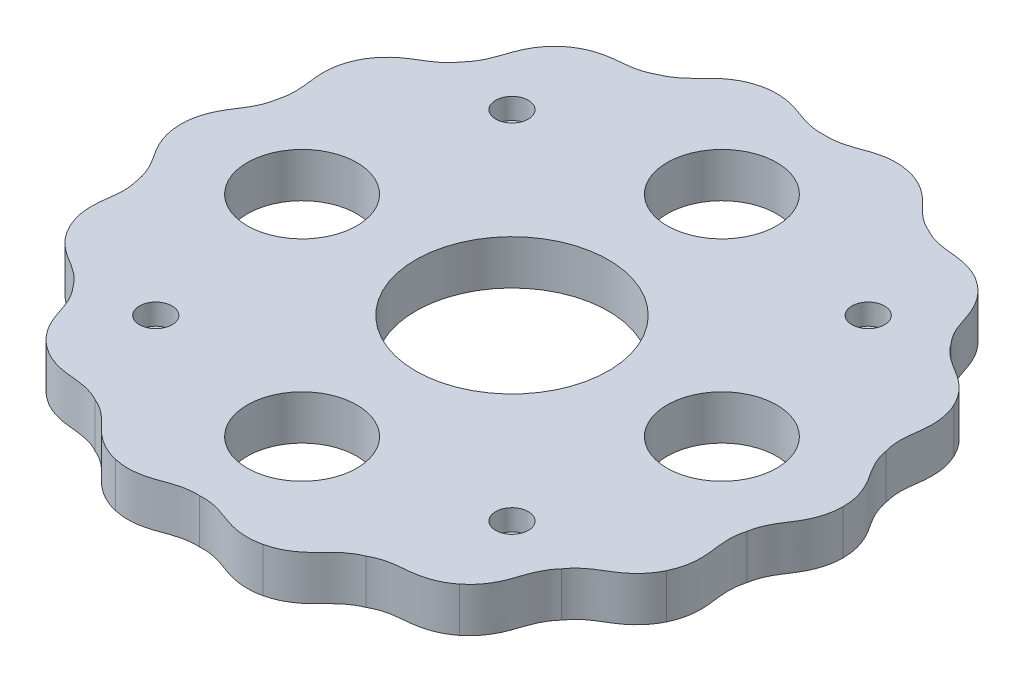
from build123d import *

# Parameters (mm, degrees)
BOSS_EXTRUDE3_DEPTH = 4.7625
SKETCH2_R           = 5.875
SKETCH2_R_2         = 10.328125
CUT_EXTRUDE1_DEPTH  = 4.7625
SKETCH2_4_R         = 1.75
CUT_EXTRUDE2_DEPTH  = 2.245833333


with BuildPart() as part:
    # Sketch1 → Boss-Extrude3 (new body)
    with BuildSketch(Plane(origin=(0, 0, 0), x_dir=(1, 0, 0), z_dir=(0, 1, 0))):
        with BuildLine():
            Line((35.500002326, 0.003735881), (35.500002326, 0))
            Line((35.500002326, 0), (35.500002326, -0.003735881))
            add(Edge.make_bspline(
                [(32.644810899, -7.45096506), (32.674793712, -7.260710929), (32.757965618, -6.873262555), (32.975088878, -6.197475635), (33.30681421, -5.487322542), (33.693887271, -4.83935734), (34.139372051, -4.165162167), (34.499748971, -3.6014921), (34.870711868, -2.889611748), (35.149566879, -2.192738575), (35.418263863, -1.23361479), (35.50061524, -0.495919336), (35.500002326, -0.003735881)],
                knots=[0.02301065, 0.02301065, 0.02301065, 0.02301065, 0.053541567, 0.084072485, 0.145134319, 0.206196153, 0.267257988, 0.389381656, 0.511505325, 0.633628994, 0.755752663, 1, 1, 1, 1], degree=3))
            add(Edge.make_bspline(
                [(31.986017844, -15.399507835), (32.200120458, -14.956331799), (32.445998494, -14.255960238), (32.62005909, -13.275236314), (32.671181344, -12.526384626), (32.645828632, -11.724047822), (32.565707523, -11.059836954), (32.456861927, -10.25911949), (32.389262714, -9.507378309), (32.398512397, -8.723622254), (32.496104055, -8.020553026), (32.589276306, -7.635387164), (32.644810899, -7.45096506)],
                knots=[0.02301065, 0.02301065, 0.02301065, 0.02301065, 0.267257988, 0.389381656, 0.511505325, 0.633628994, 0.755752663, 0.816814497, 0.877876331, 0.938938166, 0.969469083, 1, 1, 1, 1], degree=3))
            Line((31.986017844, -15.399507835), (31.984396906, -15.402873748))
            Line((31.984396906, -15.402873748), (31.982775968, -15.406239661))
            add(Edge.make_bspline(
                [(26.179105738, -20.877140171), (26.288667493, -20.718736177), (26.531710341, -20.405744191), (27.020544594, -19.891087467), (27.62754267, -19.395191866), (28.257425012, -18.979340099), (28.951315253, -18.565199839), (29.520570914, -18.213712342), (30.163670245, -17.733285076), (30.717271866, -17.226414698), (31.375507699, -16.478857279), (31.769777787, -15.849947564), (31.982775968, -15.406239661)],
                knots=[0.02301065, 0.02301065, 0.02301065, 0.02301065, 0.053541567, 0.084072485, 0.145134319, 0.206196153, 0.267257988, 0.389381656, 0.511505325, 0.633628994, 0.755752663, 1, 1, 1, 1], degree=3))
            add(Edge.make_bspline(
                [(22.136810246, -27.752690162), (22.521996911, -27.446297993), (23.047405198, -26.921967502), (23.62974854, -26.113887841), (24.00072267, -25.461376898), (24.326001557, -24.727496287), (24.542005228, -24.094299727), (24.791357022, -23.325651886), (25.05662051, -22.619026286), (25.405013194, -21.916899767), (25.797990545, -21.325799714), (26.049053047, -21.019203188), (26.179105738, -20.877140171)],
                knots=[0.02301065, 0.02301065, 0.02301065, 0.02301065, 0.267257988, 0.389381656, 0.511505325, 0.633628994, 0.755752663, 0.816814497, 0.877876331, 0.938938166, 0.969469083, 1, 1, 1, 1], degree=3))
            Line((22.136810246, -27.752690162), (22.133889416, -27.755019446))
            Line((22.133889416, -27.755019446), (22.130968587, -27.75734873))
            add(Edge.make_bspline(
                [(14.52830762, -30.168341629), (14.695748267, -30.073161626), (15.05052444, -29.89661793), (15.714250068, -29.645025478), (16.476297475, -29.461605575), (17.224233175, -29.360231784), (18.029095404, -29.288171996), (18.694481743, -29.218483478), (19.482343797, -29.064663811), (20.201044438, -28.848188121), (21.118447439, -28.460259983), (21.746546212, -28.06469929), (22.130968587, -27.75734873)],
                knots=[0.02301065, 0.02301065, 0.02301065, 0.02301065, 0.053541567, 0.084072485, 0.145134319, 0.206196153, 0.267257988, 0.389381656, 0.511505325, 0.633628994, 0.755752663, 1, 1, 1, 1], degree=3))
            add(Edge.make_bspline(
                [(7.903135888, -34.609111839), (8.383115662, -34.500188263), (9.083990645, -34.255748926), (9.959276491, -33.780363616), (10.576626521, -33.353431213), (11.188111536, -32.833360849), (11.657457809, -32.356590942), (12.215619812, -31.772252855), (12.761207314, -31.250698702), (13.379739556, -30.769266488), (13.990268616, -30.407210225), (14.349495361, -30.239908237), (14.52830762, -30.168341629)],
                knots=[0.02301065, 0.02301065, 0.02301065, 0.02301065, 0.267257988, 0.389381656, 0.511505325, 0.633628994, 0.755752663, 0.816814497, 0.877876331, 0.938938166, 0.969469083, 1, 1, 1, 1], degree=3))
            Line((7.903135888, -34.609111839), (7.899493673, -34.60994315))
            Line((7.899493673, -34.60994315), (7.895851458, -34.610774462))
            add(Edge.make_bspline(
                [(0, -33.484333037), (0.192155866, -33.471228592), (0.588397592, -33.466099831), (1.295555593, -33.527402621), (2.061719496, -33.692786976), (2.779570716, -33.925969485), (3.535992098, -34.210262493), (4.165721189, -34.43617562), (4.942300224, -34.639429423), (5.683752409, -34.756224087), (6.678619663, -34.804759157), (7.416144457, -34.72089313), (7.895851458, -34.610774462)],
                knots=[0.02301065, 0.02301065, 0.02301065, 0.02301065, 0.053541567, 0.084072485, 0.145134319, 0.206196153, 0.267257988, 0.389381656, 0.511505325, 0.633628994, 0.755752663, 1, 1, 1, 1], degree=3))
            add(Edge.make_bspline(
                [(-7.895851458, -34.610774462), (-7.416144457, -34.72089313), (-6.678619663, -34.804759157), (-5.683752409, -34.756224087), (-4.942300224, -34.639429423), (-4.165721189, -34.43617562), (-3.535992098, -34.210262493), (-2.779570716, -33.925969485), (-2.061719496, -33.692786976), (-1.295555593, -33.527402621), (-0.588397592, -33.466099831), (-0.192155866, -33.471228592), (0, -33.484333037)],
                knots=[0.02301065, 0.02301065, 0.02301065, 0.02301065, 0.267257988, 0.389381656, 0.511505325, 0.633628994, 0.755752663, 0.816814497, 0.877876331, 0.938938166, 0.969469083, 1, 1, 1, 1], degree=3))
            Line((-7.895851458, -34.610774462), (-7.899493673, -34.60994315))
            Line((-7.899493673, -34.60994315), (-7.903135888, -34.609111839))
            add(Edge.make_bspline(
                [(-14.52830762, -30.168341629), (-14.349495361, -30.239908237), (-13.990268616, -30.407210225), (-13.379739556, -30.769266488), (-12.761207314, -31.250698702), (-12.215619812, -31.772252855), (-11.657457809, -32.356590942), (-11.188111536, -32.833360849), (-10.576626521, -33.353431213), (-9.959276491, -33.780363616), (-9.083990645, -34.255748926), (-8.383115662, -34.500188263), (-7.903135888, -34.609111839)],
                knots=[0.02301065, 0.02301065, 0.02301065, 0.02301065, 0.053541567, 0.084072485, 0.145134319, 0.206196153, 0.267257988, 0.389381656, 0.511505325, 0.633628994, 0.755752663, 1, 1, 1, 1], degree=3))
            add(Edge.make_bspline(
                [(-22.130968587, -27.75734873), (-21.746546212, -28.06469929), (-21.118447439, -28.460259983), (-20.201044438, -28.848188121), (-19.482343797, -29.064663811), (-18.694481743, -29.218483478), (-18.029095404, -29.288171996), (-17.224233175, -29.360231784), (-16.476297475, -29.461605575), (-15.714250068, -29.645025478), (-15.05052444, -29.89661793), (-14.695748267, -30.073161626), (-14.52830762, -30.168341629)],
                knots=[0.02301065, 0.02301065, 0.02301065, 0.02301065, 0.267257988, 0.389381656, 0.511505325, 0.633628994, 0.755752663, 0.816814497, 0.877876331, 0.938938166, 0.969469083, 1, 1, 1, 1], degree=3))
            Line((-22.130968587, -27.75734873), (-22.133889416, -27.755019446))
            Line((-22.133889416, -27.755019446), (-22.136810246, -27.752690162))
            add(Edge.make_bspline(
                [(-26.179105738, -20.877140171), (-26.049053047, -21.019203188), (-25.797990545, -21.325799714), (-25.405013194, -21.916899767), (-25.05662051, -22.619026286), (-24.791357022, -23.325651886), (-24.542005228, -24.094299727), (-24.326001557, -24.727496287), (-24.00072267, -25.461376898), (-23.62974854, -26.113887841), (-23.047405198, -26.921967502), (-22.521996911, -27.446297993), (-22.136810246, -27.752690162)],
                knots=[0.02301065, 0.02301065, 0.02301065, 0.02301065, 0.053541567, 0.084072485, 0.145134319, 0.206196153, 0.267257988, 0.389381656, 0.511505325, 0.633628994, 0.755752663, 1, 1, 1, 1], degree=3))
            add(Edge.make_bspline(
                [(-31.982775968, -15.406239661), (-31.769777787, -15.849947564), (-31.375507698, -16.478857279), (-30.717271866, -17.226414698), (-30.163670245, -17.733285076), (-29.520570914, -18.213712342), (-28.951315253, -18.565199839), (-28.257425012, -18.979340099), (-27.62754267, -19.395191866), (-27.020544594, -19.891087467), (-26.531710341, -20.405744191), (-26.288667493, -20.718736177), (-26.179105738, -20.877140171)],
                knots=[0.02301065, 0.02301065, 0.02301065, 0.02301065, 0.267257988, 0.389381656, 0.511505325, 0.633628994, 0.755752663, 0.816814497, 0.877876331, 0.938938166, 0.969469083, 1, 1, 1, 1], degree=3))
            Line((-31.982775968, -15.406239661), (-31.984396906, -15.402873748))
            Line((-31.984396906, -15.402873748), (-31.986017844, -15.399507835))
            add(Edge.make_bspline(
                [(-32.644810899, -7.45096506), (-32.589276306, -7.635387164), (-32.496104055, -8.020553026), (-32.398512397, -8.723622254), (-32.389262714, -9.507378309), (-32.456861927, -10.25911949), (-32.565707523, -11.059836954), (-32.645828632, -11.724047822), (-32.671181344, -12.526384626), (-32.62005909, -13.275236314), (-32.445998494, -14.255960238), (-32.200120458, -14.956331799), (-31.986017844, -15.399507835)],
                knots=[0.02301065, 0.02301065, 0.02301065, 0.02301065, 0.053541567, 0.084072485, 0.145134319, 0.206196153, 0.267257988, 0.389381656, 0.511505325, 0.633628994, 0.755752663, 1, 1, 1, 1], degree=3))
            add(Edge.make_bspline(
                [(-35.500002326, -0.003735881), (-35.50061524, -0.495919336), (-35.418263863, -1.23361479), (-35.149566879, -2.192738575), (-34.870711868, -2.889611748), (-34.499748971, -3.6014921), (-34.139372051, -4.165162167), (-33.693887271, -4.83935734), (-33.30681421, -5.487322542), (-32.975088878, -6.197475635), (-32.757965618, -6.873262555), (-32.674793712, -7.260710929), (-32.644810899, -7.45096506)],
                knots=[0.02301065, 0.02301065, 0.02301065, 0.02301065, 0.267257988, 0.389381656, 0.511505325, 0.633628994, 0.755752663, 0.816814497, 0.877876331, 0.938938166, 0.969469083, 1, 1, 1, 1], degree=3))
            Line((-35.500002326, -0.003735881), (-35.500002326, 0))
            Line((-35.500002326, 0), (-35.500002326, 0.003735881))
            add(Edge.make_bspline(
                [(-32.644810899, 7.45096506), (-32.674793712, 7.260710929), (-32.757965618, 6.873262555), (-32.975088878, 6.197475635), (-33.30681421, 5.487322542), (-33.693887271, 4.83935734), (-34.139372051, 4.165162167), (-34.499748971, 3.6014921), (-34.870711868, 2.889611748), (-35.149566879, 2.192738575), (-35.418263863, 1.23361479), (-35.50061524, 0.495919336), (-35.500002326, 0.003735881)],
                knots=[0.02301065, 0.02301065, 0.02301065, 0.02301065, 0.053541567, 0.084072485, 0.145134319, 0.206196153, 0.267257988, 0.389381656, 0.511505325, 0.633628994, 0.755752663, 1, 1, 1, 1], degree=3))
            add(Edge.make_bspline(
                [(-31.986017844, 15.399507835), (-32.200120458, 14.956331799), (-32.445998494, 14.255960238), (-32.62005909, 13.275236314), (-32.671181344, 12.526384626), (-32.645828632, 11.724047822), (-32.565707523, 11.059836954), (-32.456861927, 10.25911949), (-32.389262714, 9.507378309), (-32.398512397, 8.723622254), (-32.496104055, 8.020553026), (-32.589276306, 7.635387164), (-32.644810899, 7.45096506)],
                knots=[0.02301065, 0.02301065, 0.02301065, 0.02301065, 0.267257988, 0.389381656, 0.511505325, 0.633628994, 0.755752663, 0.816814497, 0.877876331, 0.938938166, 0.969469083, 1, 1, 1, 1], degree=3))
            Line((-31.986017844, 15.399507835), (-31.984396906, 15.402873748))
            Line((-31.984396906, 15.402873748), (-31.982775968, 15.406239661))
            add(Edge.make_bspline(
                [(-26.179105738, 20.877140171), (-26.288667493, 20.718736177), (-26.531710341, 20.405744191), (-27.020544594, 19.891087467), (-27.62754267, 19.395191866), (-28.257425012, 18.979340099), (-28.951315253, 18.565199839), (-29.520570914, 18.213712342), (-30.163670245, 17.733285076), (-30.717271866, 17.226414698), (-31.375507699, 16.478857278), (-31.769777787, 15.849947564), (-31.982775968, 15.406239661)],
                knots=[0.02301065, 0.02301065, 0.02301065, 0.02301065, 0.053541567, 0.084072485, 0.145134319, 0.206196153, 0.267257988, 0.389381656, 0.511505325, 0.633628994, 0.755752663, 1, 1, 1, 1], degree=3))
            add(Edge.make_bspline(
                [(-22.136810246, 27.752690162), (-22.521996911, 27.446297993), (-23.047405198, 26.921967502), (-23.62974854, 26.113887841), (-24.00072267, 25.461376898), (-24.326001557, 24.727496287), (-24.542005228, 24.094299727), (-24.791357022, 23.325651886), (-25.05662051, 22.619026286), (-25.405013194, 21.916899767), (-25.797990545, 21.325799714), (-26.049053047, 21.019203188), (-26.179105738, 20.877140171)],
                knots=[0.02301065, 0.02301065, 0.02301065, 0.02301065, 0.267257988, 0.389381656, 0.511505325, 0.633628994, 0.755752663, 0.816814497, 0.877876331, 0.938938166, 0.969469083, 1, 1, 1, 1], degree=3))
            Line((-22.136810246, 27.752690162), (-22.133889416, 27.755019446))
            Line((-22.133889416, 27.755019446), (-22.130968587, 27.75734873))
            add(Edge.make_bspline(
                [(-14.52830762, 30.168341629), (-14.695748267, 30.073161626), (-15.05052444, 29.89661793), (-15.714250068, 29.645025478), (-16.476297475, 29.461605575), (-17.224233175, 29.360231784), (-18.029095404, 29.288171996), (-18.694481743, 29.218483478), (-19.482343797, 29.064663811), (-20.201044438, 28.848188121), (-21.118447439, 28.460259983), (-21.746546212, 28.06469929), (-22.130968587, 27.75734873)],
                knots=[0.02301065, 0.02301065, 0.02301065, 0.02301065, 0.053541567, 0.084072485, 0.145134319, 0.206196153, 0.267257988, 0.389381656, 0.511505325, 0.633628994, 0.755752663, 1, 1, 1, 1], degree=3))
            add(Edge.make_bspline(
                [(-7.903135888, 34.609111839), (-8.383115662, 34.500188263), (-9.083990645, 34.255748926), (-9.959276491, 33.780363616), (-10.576626521, 33.353431213), (-11.188111536, 32.833360849), (-11.657457809, 32.356590942), (-12.215619812, 31.772252855), (-12.761207314, 31.250698702), (-13.379739556, 30.769266488), (-13.990268616, 30.407210225), (-14.349495361, 30.239908237), (-14.52830762, 30.168341629)],
                knots=[0.02301065, 0.02301065, 0.02301065, 0.02301065, 0.267257988, 0.389381656, 0.511505325, 0.633628994, 0.755752663, 0.816814497, 0.877876331, 0.938938166, 0.969469083, 1, 1, 1, 1], degree=3))
            Line((-7.903135888, 34.609111839), (-7.899493673, 34.60994315))
            Line((-7.899493673, 34.60994315), (-7.895851458, 34.610774462))
            add(Edge.make_bspline(
                [(0, 33.484333037), (-0.192155866, 33.471228592), (-0.588397592, 33.466099831), (-1.295555593, 33.527402621), (-2.061719496, 33.692786976), (-2.779570716, 33.925969485), (-3.535992098, 34.210262493), (-4.165721189, 34.43617562), (-4.942300224, 34.639429423), (-5.683752409, 34.756224087), (-6.678619663, 34.804759157), (-7.416144457, 34.72089313), (-7.895851458, 34.610774462)],
                knots=[0.02301065, 0.02301065, 0.02301065, 0.02301065, 0.053541567, 0.084072485, 0.145134319, 0.206196153, 0.267257988, 0.389381656, 0.511505325, 0.633628994, 0.755752663, 1, 1, 1, 1], degree=3))
            add(Edge.make_bspline(
                [(7.895851458, 34.610774462), (7.416144457, 34.72089313), (6.678619663, 34.804759157), (5.683752409, 34.756224087), (4.942300224, 34.639429423), (4.165721189, 34.43617562), (3.535992098, 34.210262493), (2.779570716, 33.925969485), (2.061719496, 33.692786976), (1.295555593, 33.527402621), (0.588397592, 33.466099831), (0.192155866, 33.471228592), (0, 33.484333037)],
                knots=[0.02301065, 0.02301065, 0.02301065, 0.02301065, 0.267257988, 0.389381656, 0.511505325, 0.633628994, 0.755752663, 0.816814497, 0.877876331, 0.938938166, 0.969469083, 1, 1, 1, 1], degree=3))
            Line((7.895851458, 34.610774462), (7.899493673, 34.60994315))
            Line((7.899493673, 34.60994315), (7.903135888, 34.609111839))
            add(Edge.make_bspline(
                [(14.52830762, 30.168341629), (14.349495361, 30.239908237), (13.990268616, 30.407210225), (13.379739556, 30.769266488), (12.761207314, 31.250698702), (12.215619812, 31.772252855), (11.657457809, 32.356590942), (11.188111536, 32.833360849), (10.576626521, 33.353431213), (9.959276491, 33.780363616), (9.083990645, 34.255748926), (8.383115662, 34.500188263), (7.903135888, 34.609111839)],
                knots=[0.02301065, 0.02301065, 0.02301065, 0.02301065, 0.053541567, 0.084072485, 0.145134319, 0.206196153, 0.267257988, 0.389381656, 0.511505325, 0.633628994, 0.755752663, 1, 1, 1, 1], degree=3))
            add(Edge.make_bspline(
                [(22.130968587, 27.75734873), (21.746546212, 28.06469929), (21.118447439, 28.460259983), (20.201044438, 28.848188121), (19.482343797, 29.064663811), (18.694481743, 29.218483478), (18.029095404, 29.288171996), (17.224233175, 29.360231784), (16.476297475, 29.461605575), (15.714250068, 29.645025478), (15.05052444, 29.89661793), (14.695748267, 30.073161626), (14.52830762, 30.168341629)],
                knots=[0.02301065, 0.02301065, 0.02301065, 0.02301065, 0.267257988, 0.389381656, 0.511505325, 0.633628994, 0.755752663, 0.816814497, 0.877876331, 0.938938166, 0.969469083, 1, 1, 1, 1], degree=3))
            Line((22.130968587, 27.75734873), (22.133889416, 27.755019446))
            Line((22.133889416, 27.755019446), (22.136810246, 27.752690162))
            add(Edge.make_bspline(
                [(26.179105738, 20.877140171), (26.049053047, 21.019203188), (25.797990545, 21.325799714), (25.405013194, 21.916899767), (25.05662051, 22.619026286), (24.791357022, 23.325651886), (24.542005228, 24.094299727), (24.326001557, 24.727496287), (24.00072267, 25.461376898), (23.62974854, 26.113887841), (23.047405198, 26.921967502), (22.521996911, 27.446297993), (22.136810246, 27.752690162)],
                knots=[0.02301065, 0.02301065, 0.02301065, 0.02301065, 0.053541567, 0.084072485, 0.145134319, 0.206196153, 0.267257988, 0.389381656, 0.511505325, 0.633628994, 0.755752663, 1, 1, 1, 1], degree=3))
            add(Edge.make_bspline(
                [(31.982775968, 15.406239661), (31.769777787, 15.849947564), (31.375507698, 16.478857279), (30.717271866, 17.226414698), (30.163670245, 17.733285076), (29.520570914, 18.213712342), (28.951315253, 18.565199839), (28.257425012, 18.979340099), (27.62754267, 19.395191866), (27.020544594, 19.891087467), (26.531710341, 20.405744191), (26.288667493, 20.718736177), (26.179105738, 20.877140171)],
                knots=[0.02301065, 0.02301065, 0.02301065, 0.02301065, 0.267257988, 0.389381656, 0.511505325, 0.633628994, 0.755752663, 0.816814497, 0.877876331, 0.938938166, 0.969469083, 1, 1, 1, 1], degree=3))
            Line((31.982775968, 15.406239661), (31.984396906, 15.402873748))
            Line((31.984396906, 15.402873748), (31.986017844, 15.399507835))
            add(Edge.make_bspline(
                [(32.644810899, 7.45096506), (32.589276306, 7.635387164), (32.496104055, 8.020553026), (32.398512397, 8.723622254), (32.389262714, 9.507378309), (32.456861927, 10.25911949), (32.565707523, 11.059836954), (32.645828632, 11.724047822), (32.671181344, 12.526384626), (32.62005909, 13.275236314), (32.445998494, 14.255960238), (32.200120458, 14.956331799), (31.986017844, 15.399507835)],
                knots=[0.02301065, 0.02301065, 0.02301065, 0.02301065, 0.053541567, 0.084072485, 0.145134319, 0.206196153, 0.267257988, 0.389381656, 0.511505325, 0.633628994, 0.755752663, 1, 1, 1, 1], degree=3))
            add(Edge.make_bspline(
                [(35.500002326, 0.003735881), (35.50061524, 0.495919336), (35.418263863, 1.23361479), (35.149566879, 2.192738575), (34.870711868, 2.889611748), (34.499748971, 3.6014921), (34.139372051, 4.165162167), (33.693887271, 4.83935734), (33.30681421, 5.487322542), (32.975088878, 6.197475635), (32.757965618, 6.873262555), (32.674793712, 7.260710929), (32.644810899, 7.45096506)],
                knots=[0.02301065, 0.02301065, 0.02301065, 0.02301065, 0.267257988, 0.389381656, 0.511505325, 0.633628994, 0.755752663, 0.816814497, 0.877876331, 0.938938166, 0.969469083, 1, 1, 1, 1], degree=3))
        make_face()
    extrude(amount=BOSS_EXTRUDE3_DEPTH)

    # Sketch2 → Cut-Extrude1 (cut)
    with BuildSketch(Plane(origin=(0, 4.7625, 0), x_dir=(1, 0, 0), z_dir=(0, 1, 0))):
        with Locations((22.5, 0)):
            Circle(SKETCH2_R)
        Circle(SKETCH2_R_2)
        with Locations((0, -22.5)):
            Circle(SKETCH2_R)
        with Locations((-22.5, 0)):
            Circle(SKETCH2_R)
        with Locations((0, 22.5)):
            Circle(SKETCH2_R)
    extrude(amount=-CUT_EXTRUDE1_DEPTH, mode=Mode.SUBTRACT)

    # Sketch2<4> → Cut-Extrude2 (cut)
    with BuildSketch(Plane(origin=(0, 4.7625, 0), x_dir=(1, 0, 0), z_dir=(0, 1, 0))):
        with Locations((19.091883092, 19.091883092)):
            Circle(SKETCH2_4_R)
        with Locations((19.091883092, -19.091883092)):
            Circle(SKETCH2_4_R)
        with Locations((-19.091883092, -19.091883092)):
            Circle(SKETCH2_4_R)
        with Locations((-19.091883092, 19.091883092)):
            Circle(SKETCH2_4_R)
    extrude(amount=-CUT_EXTRUDE2_DEPTH, mode=Mode.SUBTRACT)


solid = part.part
